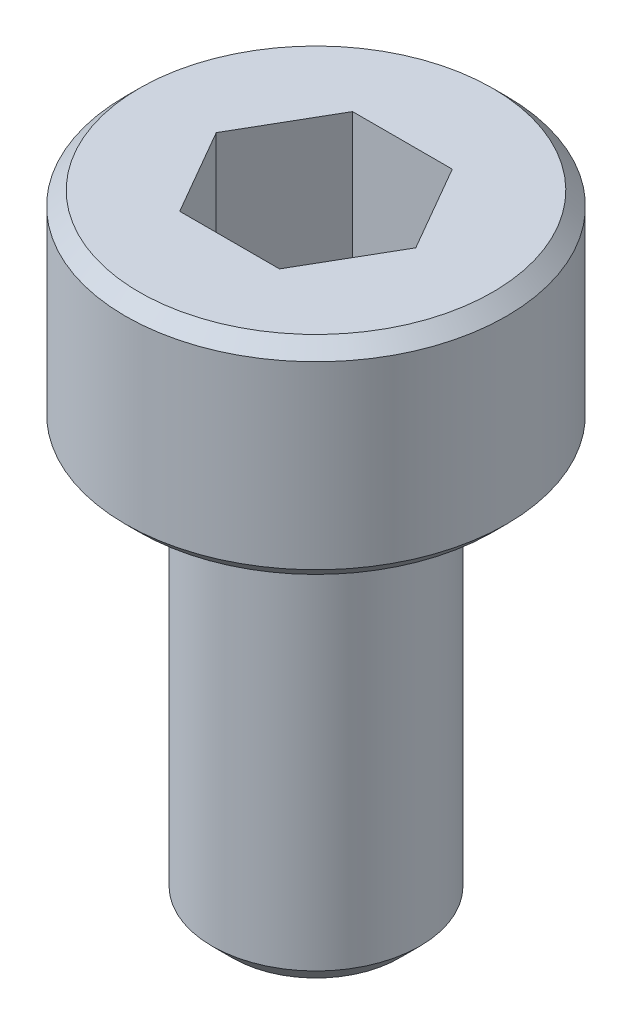
from build123d import *

# Parameters (mm, degrees)
CHAMFER_1_SIZE      = 0.2
CHAMFER_2_SIZE      = 0.3
CUT_EXTRUDE_1_DEPTH = 2.5


with BuildPart() as part:
    # 草图1 → 旋转1 (revolve)
    with BuildSketch(Plane.XY, mode=Mode.PRIVATE) as revolve_1_sk:
        Polygon((1.5, 0), (2.75, 0), (2.75, 3), (0, 3), (0, 0), (0, -6), (1.5, -6), align=None)
    revolve(revolve_1_sk.sketch.rotate(Axis((0, 3, 0), (0, -1, 0)), 90), axis=Axis((0, 3, 0), (0, -1, 0)))

    # 倒角1
    chamfer_1_edges = [part.edges().sort_by_distance(p)[0] for p in [
        (0, 3, -2.75),
        (0, 0, -2.75),
    ]]
    chamfer(chamfer_1_edges, length=CHAMFER_1_SIZE)

    # 倒角2
    chamfer_2_edges = [part.edges().sort_by_distance(p)[0] for p in [
        (0, -6, -1.5),
    ]]
    chamfer(chamfer_2_edges, length=CHAMFER_2_SIZE)

    # 草图2 → 切除-拉伸1 (cut)
    with BuildSketch(Plane(origin=(0, 3, 0), x_dir=(1, 0, 0), z_dir=(0, 1, 0))):
        Polygon((-0.72, 1.247076581), (0.72, 1.247076581), (1.44, 0), (0.72, -1.247076581), (-0.72, -1.247076581), (-1.44, 0), align=None)
    extrude(amount=-CUT_EXTRUDE_1_DEPTH, mode=Mode.SUBTRACT)


solid = part.part
